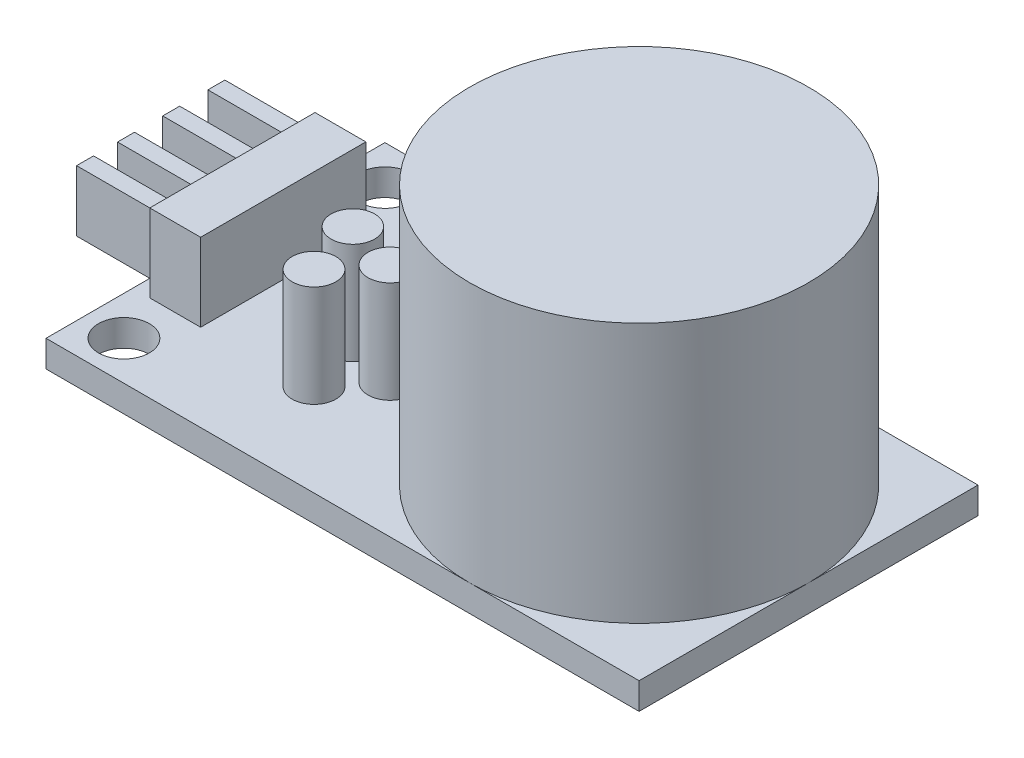
from build123d import *

# Parameters (mm, degrees)
SKETCH1_W           = 35
SKETCH1_H           = 20
SKETCH1_R           = 1.5
BOSS_EXTRUDE1_DEPTH = 1.57
SKETCH2_R           = 10
BOSS_EXTRUDE2_DEPTH = 15.34
SKETCH3_W           = 3
SKETCH3_H           = 9.75
BOSS_EXTRUDE3_DEPTH = 4.6
SKETCH4_W           = 8.75
SKETCH4_H           = 3.6
BOSS_EXTRUDE4_DEPTH = 4.82
SKETCH5_W           = 1.666666667
SKETCH5_H           = 3.6
SKETCH5_W_2         = 1.666666666
SKETCH5_W_3         = 1.416666667
CUT_EXTRUDE1_DEPTH  = 4.82
SKETCH6_R           = 1.29689407
SKETCH6_R_2         = 1.720847255
SKETCH6_R_3         = 1.291006222
SKETCH6_R_4         = 1.284790683
BOSS_EXTRUDE5_DEPTH = 6
SKETCH7_R           = 2.5
BOSS_EXTRUDE6_DEPTH = 2


with BuildPart() as part:
    # Sketch1 → Boss-Extrude1 (new body)
    with BuildSketch(Plane(origin=(0, 0, 0), x_dir=(1, 0, 0), z_dir=(0, 1, 0))):
        with Locations((17.5, 10)):
            Rectangle(SKETCH1_W, SKETCH1_H)
        with Locations(Location((2.3, 17.7, 0), (0, 0, 270))):
            Circle(SKETCH1_R, mode=Mode.SUBTRACT)
        with Locations(Location((2.3, 2.3, 0), (0, 0, 270))):
            Circle(SKETCH1_R, mode=Mode.SUBTRACT)
    extrude(amount=BOSS_EXTRUDE1_DEPTH)

    # Sketch2 → Boss-Extrude2 (add)
    with BuildSketch(Plane(origin=(0, 1.57, 0), x_dir=(1, 0, 0), z_dir=(0, 1, 0))):
        with Locations(Location((25, 10, 0), (0, 0, 270))):
            Circle(SKETCH2_R)
    extrude(amount=BOSS_EXTRUDE2_DEPTH)

    # Sketch3 → Boss-Extrude3 (add)
    with BuildSketch(Plane(origin=(0, 1.57, 0), x_dir=(1, 0, 0), z_dir=(0, 1, 0))):
        with Locations((2.5, 10)):
            Rectangle(SKETCH3_W, SKETCH3_H)
    extrude(amount=BOSS_EXTRUDE3_DEPTH)

    # Sketch4 → Boss-Extrude4 (add)
    with BuildSketch(Plane.ZY.offset(-1)):
        with Locations((-10, 3.87)):
            Rectangle(SKETCH4_W, SKETCH4_H)
    extrude(amount=BOSS_EXTRUDE4_DEPTH)

    # Sketch5 → Cut-Extrude1 (cut)
    with BuildSketch(Plane.ZY.offset(3.82)):
        with Locations((-12.541666666, 3.87)):
            Rectangle(SKETCH5_W, SKETCH5_H)
        with Locations((-9.875, 3.87)):
            Rectangle(SKETCH5_W_2, SKETCH5_H)
        with Locations((-7.333333334, 3.87)):
            Rectangle(SKETCH5_W_3, SKETCH5_H)
    extrude(amount=-CUT_EXTRUDE1_DEPTH, mode=Mode.SUBTRACT)

    # Sketch6 → Boss-Extrude5 (add)
    with BuildSketch(Plane(origin=(0, 1.57, 0), x_dir=(1, 0, 0), z_dir=(0, 1, 0))):
        with Locations(Location((12.406689858, 7.897918268, 0), (0, 0, 90))):
            Circle(SKETCH6_R)
        with Locations(Location((11.577372326, 12.210536894, 0), (0, 0, 90))):
            Circle(SKETCH6_R_2)
        with Locations(Location((10.375255256, 5.440145452, 0), (0, 0, 90))):
            Circle(SKETCH6_R_3)
        with Locations(Location((9.342761815, 8.766255662, 0), (0, 0, 90))):
            Circle(SKETCH6_R_4)
    extrude(amount=BOSS_EXTRUDE5_DEPTH)

    # Sketch7 → Boss-Extrude6 (add)
    with BuildSketch(Plane.XZ):
        with Locations(Location((25, -10, 0), (0, 0, 270))):
            Circle(SKETCH7_R)
    extrude(amount=BOSS_EXTRUDE6_DEPTH)


solid = part.part
